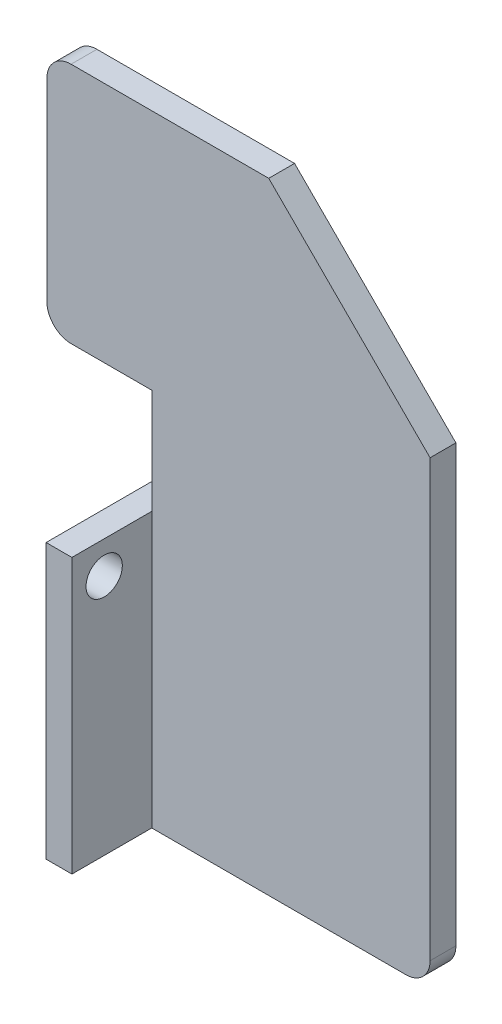
from build123d import *

# Parameters (mm, degrees)
EXTRUDE_1_DEPTH          = 1.6
EXTRUDE_1_DEPTH_BACK     = 1.6
EXTRUDE_2_DEPTH          = 11.5
EXTRUDE_2_DEPTH_BACK     = 11.5
SKETCH_2_W               = 3.2
SKETCH_2_H               = 34
CUT_EXTRUDE_1_DEPTH      = 87.501676284
CUT_EXTRUDE_1_DEPTH_BACK = 87.501676284
SKETCH_3_R               = 2.25


with BuildPart() as part:
    # ｽｹｯﾁ1 → ﾎﾞｽ - 押し出し1 (new, two sides: drawn at the far end of the back side and taken through both)
    with BuildSketch(Plane.XY.offset(-EXTRUDE_1_DEPTH_BACK)):
        with BuildLine():
            Line((3.2, 0), (34.7, 0))
            ThreePointArc((34.7, 0), (36.821320344, 0.878679656), (37.7, 3))
            Line((37.7, 3), (37.7, 57))
            Line((37.7, 57), (17.7, 77))
            Line((17.7, 77), (-6.8, 77))
            ThreePointArc((-6.8, 77), (-8.921320344, 76.121320344), (-9.8, 74))
            Line((-9.8, 74), (-9.8, 50))
            ThreePointArc((-9.8, 50), (-8.921320344, 47.878679656), (-6.8, 47))
            Line((-6.8, 47), (3.2, 47))
            Line((3.2, 47), (3.2, 0))
        make_face()
    extrude(amount=EXTRUDE_1_DEPTH + EXTRUDE_1_DEPTH_BACK)

    # ｽｹｯﾁ2 → ﾎﾞｽ - 押し出し2 (add, two sides: drawn at the far end of the back side and taken through both)
    with BuildSketch(Plane.XY.offset(-EXTRUDE_2_DEPTH_BACK)):
        with Locations((1.6, 17)):
            Rectangle(SKETCH_2_W, SKETCH_2_H)
    extrude(amount=EXTRUDE_2_DEPTH + EXTRUDE_2_DEPTH_BACK)

    # ｽｹｯﾁ3 → ｶｯﾄ - 押し出し1 (cut, two sides: drawn at the far end of the back side and taken through both)
    with BuildSketch(Plane(origin=(0, 0, 0), x_dir=(0, 0, -1), z_dir=(1, 0, 0)).offset(-CUT_EXTRUDE_1_DEPTH_BACK)):
        with Locations((-7.5, 30)):
            Circle(SKETCH_3_R)
        with Locations((7.5, 4)):
            Circle(SKETCH_3_R)
    extrude(amount=CUT_EXTRUDE_1_DEPTH + CUT_EXTRUDE_1_DEPTH_BACK, mode=Mode.SUBTRACT)


solid = part.part
